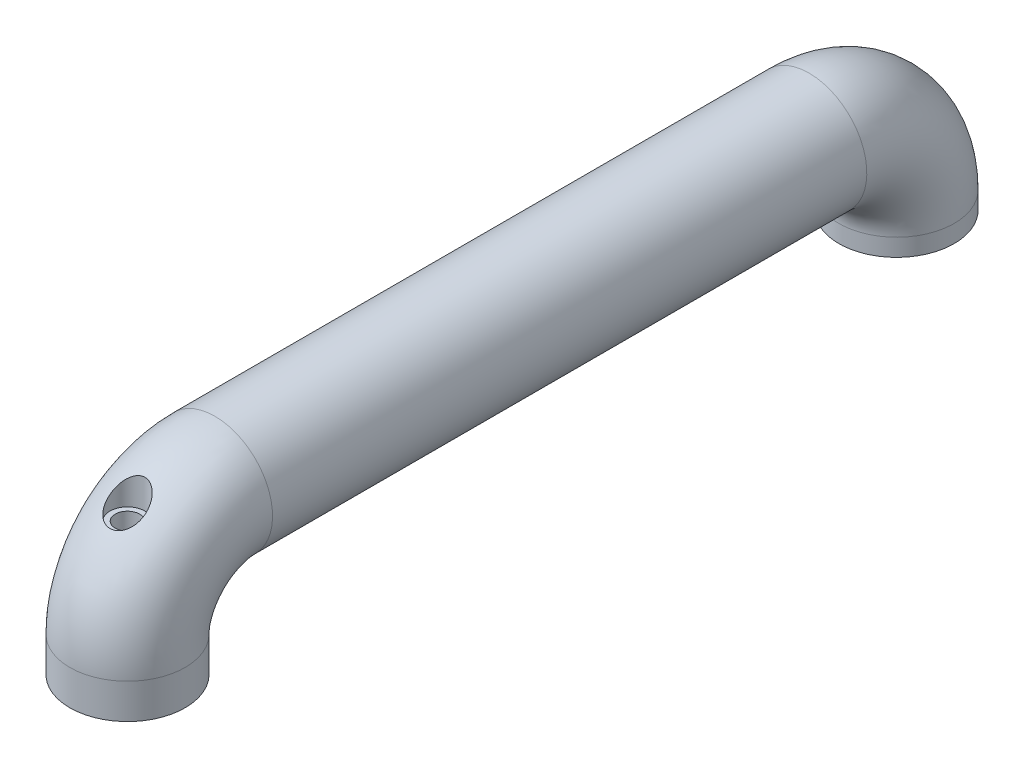
from build123d import *

# Parameters (mm, degrees)
SWEEP1_PROFILE_R   = 16.5
SKETCH10_W         = 17
SKETCH10_H         = 17
CUT_EXTRUDE1_DEPTH = 25
SKETCH11_R         = 3.5
CUT_EXTRUDE2_DEPTH = 13
SKETCH12_R         = 5
CUT_EXTRUDE3_DEPTH = 13


with BuildPart() as part:
    # Sweep1: sweep along a path in Sketch1
    with BuildLine(Plane(origin=(0, 0, 0), x_dir=(0, 0, -1), z_dir=(1, 0, 0))) as sweep1_path:
        Line((81.472527473, -41.846153846), (81.472527473, -36.846153846))
        ThreePointArc((81.472527473, -36.846153846), (74.150197002, -19.168484316), (56.472527473, -11.846153846))
        Line((56.472527473, -11.846153846), (-113.527472527, -11.846153846))
        ThreePointArc((-113.527472527, -11.846153846), (-131.205142057, -19.168484316), (-138.527472527, -36.846153846))
        Line((-138.527472527, -36.846153846), (-138.527472527, -46.846153846))
    # Sweep1 profile (on start of the path) → Sweep1 (sweep)
    with BuildSketch(Plane(origin=(0, -41.846153846, -81.472527473), x_dir=(0, 0, 1), z_dir=(0, 1, 0))):
        Circle(SWEEP1_PROFILE_R)
    sweep(path=sweep1_path.line)

    # Sketch10 → Cut-Extrude1 (cut)
    with BuildSketch(Plane.XZ.offset(46.846153846)):
        with Locations((0, 138.527472527)):
            Rectangle(SKETCH10_W, SKETCH10_H)
    extrude(amount=-CUT_EXTRUDE1_DEPTH, mode=Mode.SUBTRACT)

    # Sketch11 → Cut-Extrude2 (cut)
    with BuildSketch(Plane.XZ.offset(21.846153846)):
        with Locations(Location((0, 138.527472527, 0), (0, 0, 270))):
            Circle(SKETCH11_R)
    extrude(amount=-CUT_EXTRUDE2_DEPTH, mode=Mode.SUBTRACT)

    # Sketch12 → Cut-Extrude3 (cut)
    with BuildSketch(Plane.XZ.offset(8.846153846)):
        with Locations(Location((0, 138.527472527, 0), (0, 0, 270))):
            Circle(SKETCH12_R)
    extrude(amount=-CUT_EXTRUDE3_DEPTH, mode=Mode.SUBTRACT)


solid = part.part
